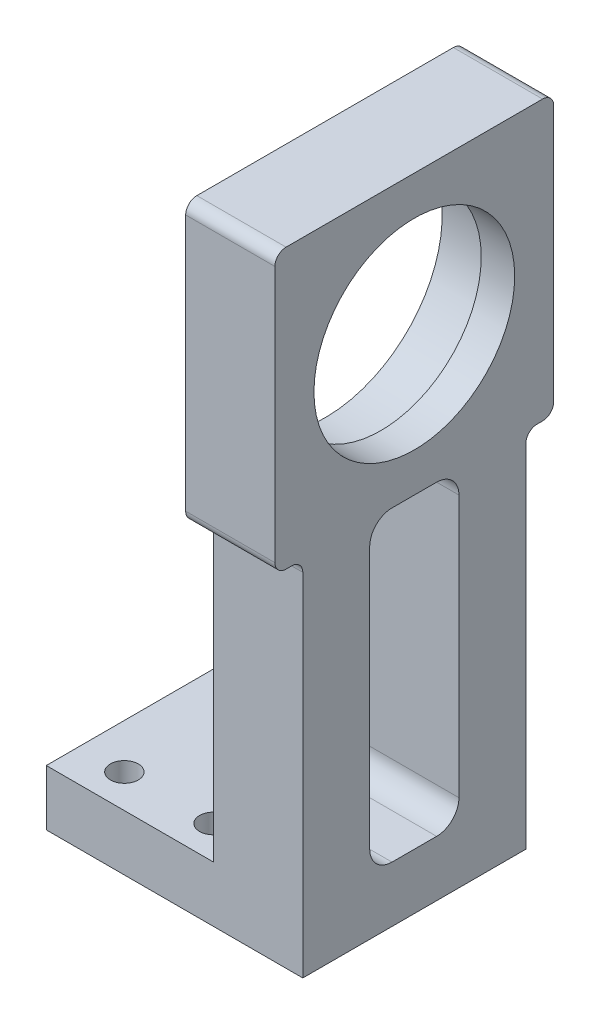
from build123d import *

# Parameters (mm, degrees)
SKETCH1_W                = 20
SKETCH1_H                = 20
BOSS_EXTRUDE1_DEPTH      = 5
BOSS_EXTRUDE2_DEPTH      = 3
BOSS_EXTRUDE2_DEPTH_BACK = 5
SKETCH2_W                = 6
SKETCH2_H                = 27.5
SKETCH2_W_2              = 20
SKETCH2_H_2              = 5
CUT_EXTRUDE1_REACH       = 63.575
SKETCH4_R                = 1.25
SKETCH8_R                = 10.5
CUT_EXTRUDE4_DEPTH       = 5
CUT_EXTRUDE5_REACH       = 66.904
SKETCH9_R                = 9
FILLET2_R                = 1
FILLET3_R                = 2


with BuildPart() as part:
    # Sketch1 → Boss-Extrude1 (new body)
    with BuildSketch(Plane(origin=(0, 0, 0), x_dir=(1, 0, 0), z_dir=(0, 1, 0))):
        with Locations((10, 10)):
            Rectangle(SKETCH1_W, SKETCH1_H)
    extrude(amount=BOSS_EXTRUDE1_DEPTH)

    # Sketch2 → Boss-Extrude2 (add, two sides: drawn at the far end of the back side and taken through both)
    with BuildSketch(Plane(origin=(20, 0, 0), x_dir=(0, 0, -1), z_dir=(1, 0, 0)).offset(-BOSS_EXTRUDE2_DEPTH_BACK)):
        with Locations((17, 18.75)):
            Rectangle(SKETCH2_W, SKETCH2_H)
        with Locations((3, 18.75)):
            Rectangle(SKETCH2_W, SKETCH2_H)
        with Locations((10, 2.5)):
            Rectangle(SKETCH2_W_2, SKETCH2_H_2)
        Polygon((-2.5, 32.5), (0, 32.5), (6, 32.5), (14, 32.5), (20, 32.5), (22.5, 32.5), (22.5, 57.5), (-2.5, 57.5), align=None)
    extrude(amount=BOSS_EXTRUDE2_DEPTH + BOSS_EXTRUDE2_DEPTH_BACK)

    # Sketch4 → Cut-Extrude1 (cut, up to next)
    with BuildSketch(Plane(origin=(0, 5, 0), x_dir=(1, 0, 0), z_dir=(0, 1, 0)), mode=Mode.PRIVATE) as cut_extrude1_sk1:
        with Locations(Location((12, 3, 0), (0, 0, 270))):
            Circle(SKETCH4_R)
    cut_extrude1_tool1 = extrude(cut_extrude1_sk1.sketch, amount=-CUT_EXTRUDE1_REACH, mode=Mode.PRIVATE) & part.part
    # Sketch4 → Cut-Extrude1 (cut, up to next)
    with BuildSketch(Plane(origin=(0, 5, 0), x_dir=(1, 0, 0), z_dir=(0, 1, 0)), mode=Mode.PRIVATE) as cut_extrude1_sk2:
        with Locations(Location((4, 3, 0), (0, 0, 270))):
            Circle(SKETCH4_R)
    cut_extrude1_tool2 = extrude(cut_extrude1_sk2.sketch, amount=-CUT_EXTRUDE1_REACH, mode=Mode.PRIVATE) & part.part
    # Sketch4 → Cut-Extrude1 (cut, up to next)
    with BuildSketch(Plane(origin=(0, 5, 0), x_dir=(1, 0, 0), z_dir=(0, 1, 0)), mode=Mode.PRIVATE) as cut_extrude1_sk3:
        with Locations(Location((12, 17, 0), (0, 0, 90))):
            Circle(SKETCH4_R)
    cut_extrude1_tool3 = extrude(cut_extrude1_sk3.sketch, amount=-CUT_EXTRUDE1_REACH, mode=Mode.PRIVATE) & part.part
    # Sketch4 → Cut-Extrude1 (cut, up to next)
    with BuildSketch(Plane(origin=(0, 5, 0), x_dir=(1, 0, 0), z_dir=(0, 1, 0)), mode=Mode.PRIVATE) as cut_extrude1_sk4:
        with Locations(Location((4, 17, 0), (0, 0, 90))):
            Circle(SKETCH4_R)
    cut_extrude1_tool4 = extrude(cut_extrude1_sk4.sketch, amount=-CUT_EXTRUDE1_REACH, mode=Mode.PRIVATE) & part.part
    add(cut_extrude1_tool1.solids().sort_by_distance((12, 5, -3))[0], mode=Mode.SUBTRACT)
    add(cut_extrude1_tool2.solids().sort_by_distance((4, 5, -3))[0], mode=Mode.SUBTRACT)
    add(cut_extrude1_tool3.solids().sort_by_distance((12, 5, -17))[0], mode=Mode.SUBTRACT)
    add(cut_extrude1_tool4.solids().sort_by_distance((4, 5, -17))[0], mode=Mode.SUBTRACT)

    # Sketch8 → Cut-Extrude4 (cut)
    with BuildSketch(Plane.ZY.offset(-15)):
        with Locations((-10, 45)):
            Circle(SKETCH8_R)
    extrude(amount=-CUT_EXTRUDE4_DEPTH, mode=Mode.SUBTRACT)

    # Sketch9 → Cut-Extrude5 (cut, up to next)
    with BuildSketch(Plane.ZY.offset(-20), mode=Mode.PRIVATE) as cut_extrude5_sk1:
        with Locations((-10, 45)):
            Circle(SKETCH9_R)
    cut_extrude5_tool1 = extrude(cut_extrude5_sk1.sketch, amount=-CUT_EXTRUDE5_REACH, mode=Mode.PRIVATE) & part.part
    add(cut_extrude5_tool1.solids().sort_by_distance((20, 45, -10))[0], mode=Mode.SUBTRACT)

    # Fillet2
    fillet2_edges = [part.edges().sort_by_distance(p)[0] for p in [
        (19, 32.5, -20),
        (19, 32.5, 0),
        (19, 32.5, 2.5),
        (19, 57.5, 2.5),
        (19, 57.5, -22.5),
        (19, 32.5, -22.5),
    ]]
    fillet(fillet2_edges, radius=FILLET2_R)

    # Fillet3
    fillet3_edges = [part.edges().sort_by_distance(p)[0] for p in [
        (19, 5, -6),
        (19, 32.5, -6),
        (19, 5, -14),
        (19, 32.5, -14),
    ]]
    fillet(fillet3_edges, radius=FILLET3_R)


solid = part.part
